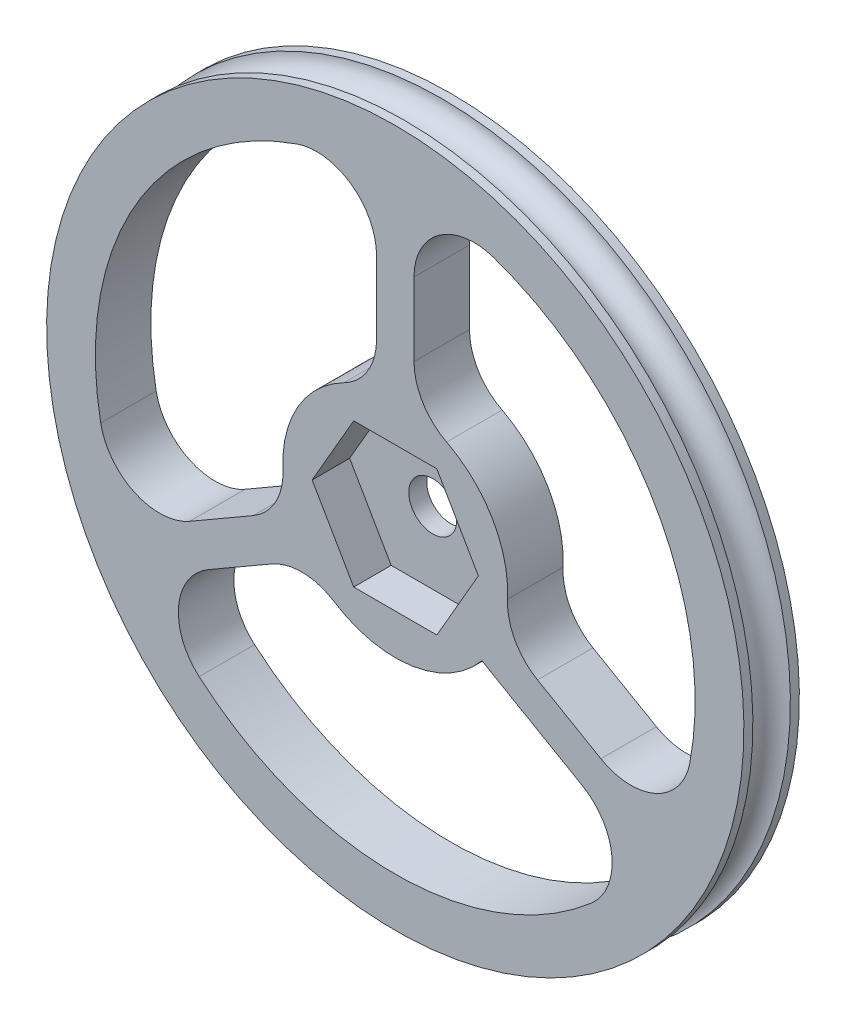
from build123d import *

# Parameters (mm, degrees)
SKETCH1_R           = 9.525
BOSS_EXTRUDE1_DEPTH = 4.699
CUT_EXTRUDE1_DEPTH  = 3.175
SKETCH5_R           = 2.032
CUT_EXTRUDE2_DEPTH  = 43.021745862
FILLET1_R           = 5.08


with BuildPart() as part:
    # Sketch1 → Boss-Extrude1 (new body)
    with BuildSketch(Plane.XY):
        with BuildLine():
            ThreePointArc((1.5875, 25.350342083), (0, 25.4), (-1.5875, 25.350342083))
            Line((-1.5875, 25.350342083), (-1.5875, 9.391776656))
            ThreePointArc((-1.5875, 9.391776656), (0, 9.525), (1.5875, 9.391776656))
            Line((1.5875, 9.391776656), (1.5875, 25.350342083))
        make_face()
        Circle(SKETCH1_R)
        with BuildLine():
            ThreePointArc((21.160290239, -14.04998637), (21.997045256, -12.7), (22.747790239, -11.300355713))
            Line((22.747790239, -11.300355713), (8.92726717, -3.321072999))
            ThreePointArc((8.92726717, -3.321072999), (8.248891971, -4.7625), (7.33976717, -6.070703656))
            Line((7.33976717, -6.070703656), (21.160290239, -14.04998637))
        make_face()
        with BuildLine():
            Line((-8.92726717, -3.321072999), (-22.747790239, -11.300355713))
            ThreePointArc((-22.747790239, -11.300355713), (-21.997045256, -12.7), (-21.160290239, -14.04998637))
            Line((-21.160290239, -14.04998637), (-7.33976717, -6.070703656))
            ThreePointArc((-7.33976717, -6.070703656), (-8.248891971, -4.7625), (-8.92726717, -3.321072999))
        make_face()
    extrude(amount=-BOSS_EXTRUDE1_DEPTH)

    # Sweep1: sweep along a path in Sketch4
    with BuildLine(Plane.XY) as sweep1_path:
        CenterArc((0, 0), 25.4, 0, 360)
    # Sketch3 → Sweep1 (sweep)
    with BuildSketch(Plane(origin=(0, 0, 0), x_dir=(0, 0, -1), z_dir=(1, 0, 0))):
        with BuildLine():
            Line((0, 25.4), (0, 29.5275))
            Line((0, 29.5275), (0.762, 29.5275))
            ThreePointArc((0.762, 29.5275), (2.3495, 27.94), (3.937, 29.5275))
            Line((3.937, 29.5275), (4.699, 29.5275))
            Line((4.699, 29.5275), (4.699, 25.4))
            Line((4.699, 25.4), (0, 25.4))
        make_face()
    sweep(path=sweep1_path.line)

    # Sketch2 → Cut-Extrude1 (cut)
    with BuildSketch(Plane.XY):
        Polygon((7.039054482, 0), (3.519527241, 6.096), (-3.519527241, 6.096), (-7.039054482, 0), (-3.519527241, -6.096), (3.519527241, -6.096), align=None)
    extrude(amount=-CUT_EXTRUDE1_DEPTH, mode=Mode.SUBTRACT)

    # Sketch5 → Cut-Extrude2 (cut, through all)
    with BuildSketch(Plane.XY):
        Circle(SKETCH5_R)
    extrude(amount=-CUT_EXTRUDE2_DEPTH, mode=Mode.SUBTRACT)

    # Fillet1
    fillet1_edges = [part.edges().sort_by_distance(p)[0] for p in [
        (-1.5875, 25.350342083, -2.3495),
        (1.5875, 25.350342083, -2.3495),
        (1.5875, 9.391776656, -2.3495),
        (8.92726717, -3.321072999, -2.3495),
        (22.747790239, -11.300355713, -2.3495),
        (21.160290239, -14.04998637, -2.3495),
        (-7.33976717, -6.070703656, -2.3495),
        (-21.160290239, -14.04998637, -2.3495),
        (-22.747790239, -11.300355713, -2.3495),
        (-8.92726717, -3.321072999, -2.3495),
        (-1.5875, 9.391776656, -2.3495),
    ]]
    fillet(fillet1_edges, radius=FILLET1_R)


solid = part.part
